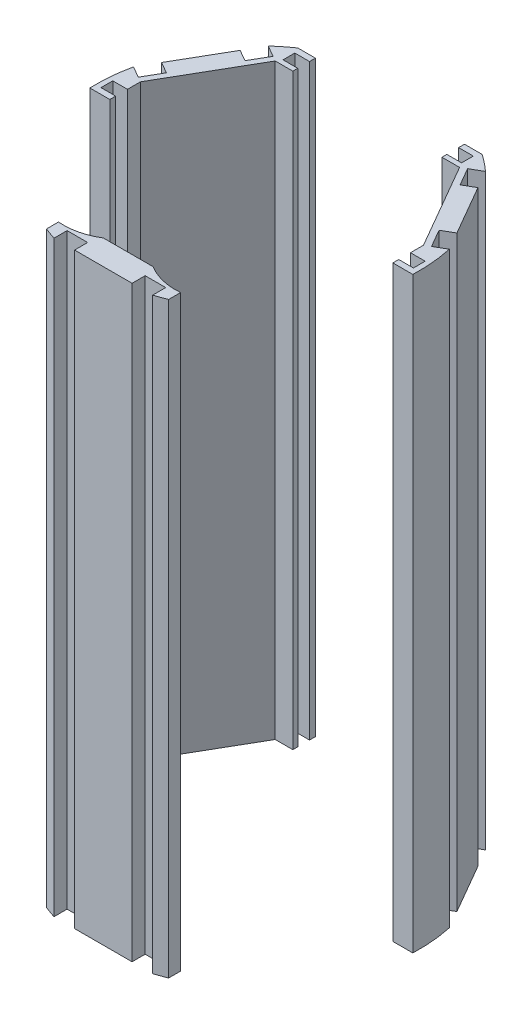
from build123d import *

# Parameters (mm, degrees)
BOSS_EXTRUDE1_DEPTH = 100


with BuildPart() as part:
    # Sketch1 → Boss-Extrude1 (new body)
    with BuildSketch(Plane(origin=(0, 0, 0), x_dir=(1, 0, 0), z_dir=(0, 1, 0))):
        with BuildLine():
            ThreePointArc((-10.393980876, -25.460069944), (-9.401021566, -25.843196271), (-8.393980876, -26.187613199))
            Line((-8.393980876, -26.187613199), (-8.393980876, -23.960737702))
            Line((-8.393980876, -23.960737702), (-4.893980876, -23.960737702))
            Line((-4.893980876, -23.960737702), (-4.893980876, -26.187613199))
            Line((-4.893980876, -26.187613199), (-4.849695718, -26.187613199))
            Line((-4.849695718, -26.187613199), (4.893980876, -26.187613199))
            Line((4.893980876, -26.187613199), (4.893980876, -23.960737702))
            Line((4.893980876, -23.960737702), (8.393980876, -23.960737702))
            Line((8.393980876, -23.960737702), (8.393980876, -26.187613199))
            ThreePointArc((8.393980876, -26.187613199), (9.401021566, -25.843196271), (10.393980876, -25.460069944))
            Line((10.393980876, -25.460069944), (10.393980876, -23.42069745))
            ThreePointArc((10.393980876, -23.42069745), (7.194462573, -23.191333633), (4.232173124, -21.960737702))
            Line((4.232173124, -21.960737702), (-4.232173124, -21.960737702))
            ThreePointArc((-4.232173124, -21.960737702), (-7.194462573, -23.191333633), (-10.393980876, -23.42069745))
            Line((-10.393980876, -23.42069745), (-10.393980876, -25.460069944))
        make_face()
        with BuildLine():
            Line((24.081572577, -1), (27.481812167, -1))
            ThreePointArc((27.481812167, -1), (27.495452666, -0.500082692), (27.5, 0))
            ThreePointArc((27.5, 0), (27.343587367, 2.928861541), (26.876128733, 5.824405922))
            Line((26.876128733, 5.824405922), (24.947597981, 4.710968174))
            Line((24.947597981, 4.710968174), (23.197597981, 7.742057087))
            Line((23.197597981, 7.742057087), (25.126128733, 8.855494836))
            Line((25.126128733, 8.855494836), (25.103986154, 8.893846907))
            Line((25.103986154, 8.893846907), (20.232147857, 17.332118363))
            Line((20.232147857, 17.332118363), (18.303617105, 16.218680615))
            Line((18.303617105, 16.218680615), (16.553617105, 19.249769528))
            Line((16.553617105, 19.249769528), (18.482147857, 20.363207277))
            ThreePointArc((18.482147857, 20.363207277), (17.120996476, 21.520257426), (15.687591702, 22.586488585))
            Line((15.687591702, 22.586488585), (15.687591702, 18.749769528))
            Line((15.687591702, 18.749769528), (24.081572577, 4.210968174))
            Line((24.081572577, 4.210968174), (24.081572577, 2))
            Line((24.081572577, 2), (26.581572577, 2))
            Line((26.581572577, 2), (26.581572577, 0))
            Line((26.581572577, 0), (24.081572577, 0))
            Line((24.081572577, 0), (24.081572577, -1))
        make_face()
        with BuildLine():
            ThreePointArc((-26.876128733, 5.824405922), (-27.392326732, 2.431138875), (-27.481812167, -1))
            Line((-27.481812167, -1), (-24.081572577, -1))
            Line((-24.081572577, -1), (-24.081572577, 0))
            Line((-24.081572577, 0), (-26.581572577, 0))
            Line((-26.581572577, 0), (-26.581572577, 2))
            Line((-26.581572577, 2), (-24.081572577, 2))
            Line((-24.081572577, 2), (-24.081572577, 4.210968174))
            Line((-24.081572577, 4.210968174), (-15.687591702, 18.749769528))
            Line((-15.687591702, 18.749769528), (-15.687591702, 22.586488585))
            ThreePointArc((-15.687591702, 22.586488585), (-17.120996476, 21.520257426), (-18.482147857, 20.363207277))
            Line((-18.482147857, 20.363207277), (-16.553617105, 19.249769528))
            Line((-16.553617105, 19.249769528), (-18.303617105, 16.218680615))
            Line((-18.303617105, 16.218680615), (-20.232147857, 17.332118363))
            Line((-20.232147857, 17.332118363), (-20.254290436, 17.293766292))
            Line((-20.254290436, 17.293766292), (-25.126128733, 8.855494836))
            Line((-25.126128733, 8.855494836), (-23.197597981, 7.742057087))
            Line((-23.197597981, 7.742057087), (-24.947597981, 4.710968174))
            Line((-24.947597981, 4.710968174), (-26.876128733, 5.824405922))
        make_face()
        Polygon((-12.687591702, 22.586488585), (-15.687591702, 22.586488585), (-15.687591702, 18.749769528), (-12.687591702, 18.749769528), (-12.687591702, 19.586488585), (-15.187591702, 19.586488585), (-15.187591702, 21.586488585), (-12.687591702, 21.586488585), align=None)
        Polygon((15.687591702, 18.749769528), (15.687591702, 22.586488585), (12.687591702, 22.586488585), (12.687591702, 21.586488585), (15.187591702, 21.586488585), (15.187591702, 19.586488585), (12.687591702, 19.586488585), (12.687591702, 18.749769528), align=None)
    extrude(amount=BOSS_EXTRUDE1_DEPTH)


solid = part.part
